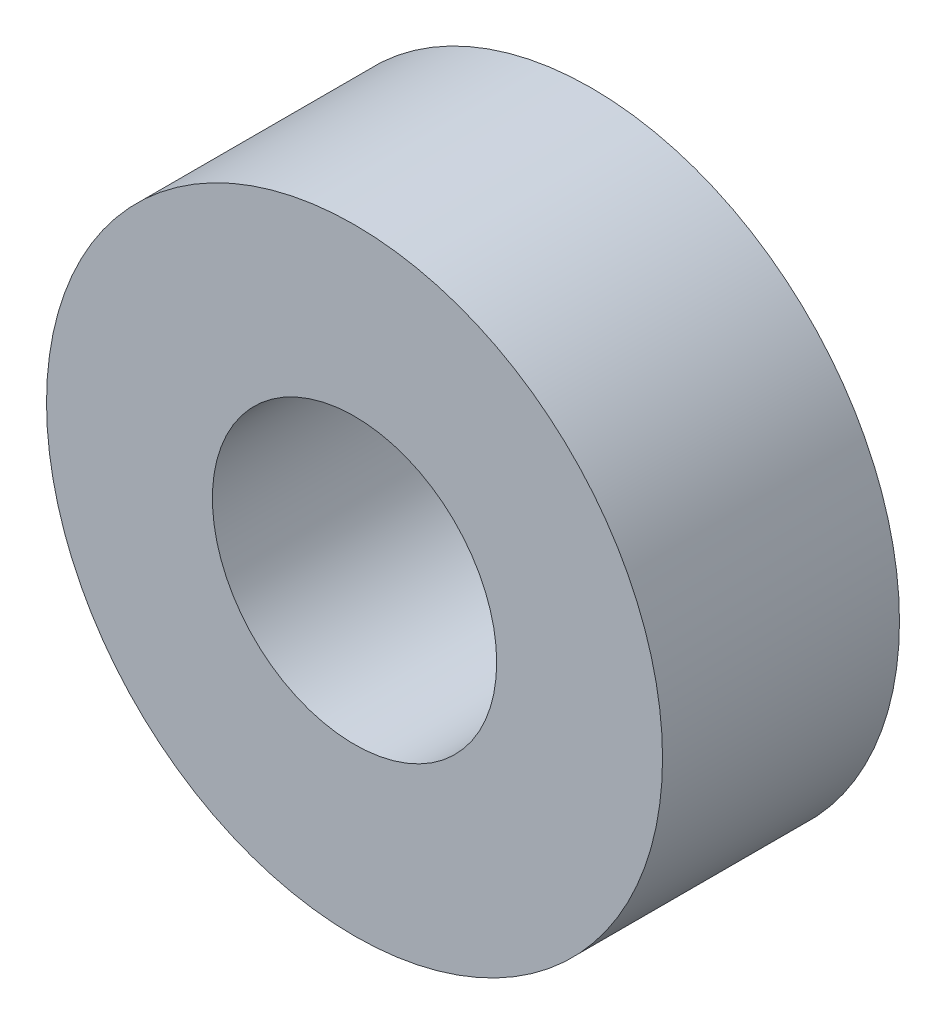
from build123d import *

# Parameters (mm, degrees)
SKETCH2_R           = 6.5
SKETCH2_R_2         = 3
BOSS_EXTRUDE1_DEPTH = 5


with BuildPart() as part:
    # Sketch2 → Boss-Extrude1 (new body)
    with BuildSketch(Plane.XY):
        Circle(SKETCH2_R)
        Circle(SKETCH2_R_2, mode=Mode.SUBTRACT)
    extrude(amount=BOSS_EXTRUDE1_DEPTH)


solid = part.part
